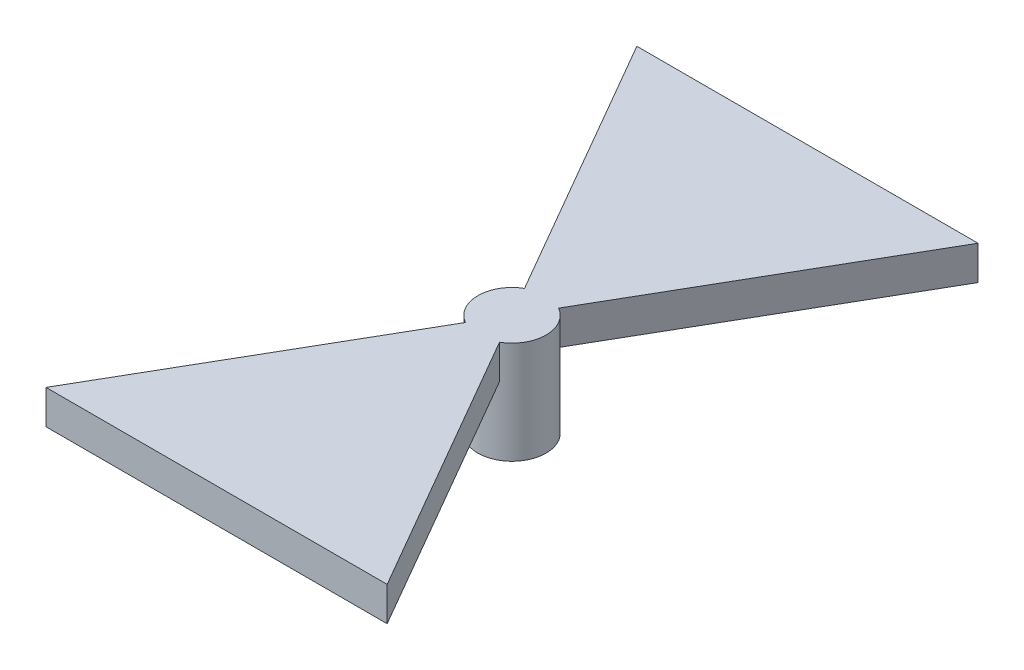
from build123d import *

# Parameters (mm, degrees)
ESBO_O1_R                = 2
ESBO_O1_R_2              = 1
RESSALTO_EXTRUS_O1_DEPTH = 4
ESBO_O2_R                = 2
RESSALTO_EXTRUS_O2_DEPTH = 2


with BuildPart() as part:
    # Esboço1 → Ressalto-extrusão1 (new body)
    with BuildSketch(Plane(origin=(0, 0, 0), x_dir=(1, 0, 0), z_dir=(0, 1, 0))):
        with Locations(Location((0, 0, 0), (0, 0, 270))):
            Circle(ESBO_O1_R)
        with Locations(Location((0, 0, 0), (0, 0, 270))):
            Circle(ESBO_O1_R_2, mode=Mode.SUBTRACT)
    extrude(amount=RESSALTO_EXTRUS_O1_DEPTH)

    # Esboço2 → Ressalto-extrusão2 (add)
    with BuildSketch(Plane(origin=(0, 4, 0), x_dir=(1, 0, 0), z_dir=(0, 1, 0))):
        with Locations(Location((0, 0, 0), (0, 0, 60))):
            Circle(ESBO_O2_R)
        Polygon((10, 17.320508076), (0, 0), (-10, 17.320508076), align=None)
        Polygon((-10, -17.320508076), (10, -17.320508076), (0, 0), align=None)
    extrude(amount=RESSALTO_EXTRUS_O2_DEPTH)


solid = part.part
